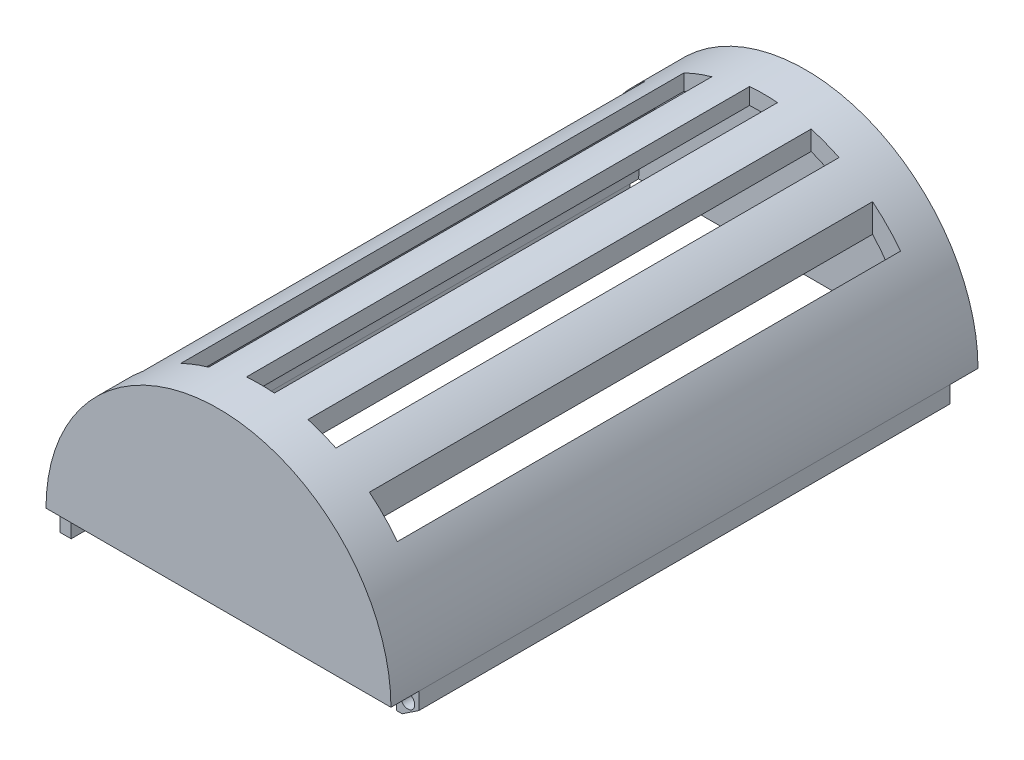
from build123d import *
from build123d.topology import SkipClean

# Parameters (mm, degrees)
EXTRUDE_1_DEPTH     = 200
SKETCH_2_W          = 10
SKETCH_2_H          = 180
CUT_EXTRUDE_1_DEPTH = 219.205820271
SKETCH_3_W          = 8
SKETCH_3_H          = 190
EXTRUDE_2_DEPTH     = 10
SKETCH_4_R          = 2.5
CUT_EXTRUDE_2_DEPTH = 214.632347738
SKETCH_5_W          = 20
SKETCH_5_H          = 3
EXTRUDE_3_DEPTH     = 10
CUT_EXTRUDE_3_DEPTH = 217.732046546
EXTRUDE_4_DEPTH     = 5
EXTRUDE_START       = 5
EXTRUDE_5_DEPTH     = 5
CUT_EXTRUDE_START   = -3
CUT_EXTRUDE_4_DEPTH = 3
CUT_EXTRUDE_5_DEPTH = 3


with BuildPart() as part:
    # 草圖1 → 填料-伸長1 (new body)
    with BuildSketch(Plane.XY):
        with BuildLine():
            Line((-61.7, 0), (-61.7, -10))
            Line((-61.7, -10), (-57.7, -10))
            Line((-57.7, -10), (-57.7, 0))
            ThreePointArc((-57.7, 0), (-2, 55.7), (53.7, 0))
            Line((53.7, 0), (61.7, 0))
            ThreePointArc((61.7, 0), (0, 61.7), (-61.7, 0))
        make_face()
    extrude(amount=EXTRUDE_1_DEPTH)

    # 草圖2 → 除料-伸長1 (cut, through all)
    with BuildSketch(Plane(origin=(0, 0, 0), x_dir=(1, 0, 0), z_dir=(0, 1, 0))):
        with Locations((0, -100)):
            Rectangle(SKETCH_2_W, SKETCH_2_H)
        with Locations((22, -100)):
            Rectangle(SKETCH_2_W, SKETCH_2_H)
        with Locations((44, -100)):
            Rectangle(SKETCH_2_W, SKETCH_2_H)
        with Locations((-21.943943619, -101.569502613)):
            Rectangle(SKETCH_2_W, SKETCH_2_H)
        with Locations((-43.887887238, -103.139005227)):
            Rectangle(SKETCH_2_W, SKETCH_2_H)
    extrude(amount=CUT_EXTRUDE_1_DEPTH, mode=Mode.SUBTRACT)

    # 草圖3 → 填料-伸長2 (add)
    with BuildSketch(Plane.XZ):
        with Locations((57.7, 100)):
            Rectangle(SKETCH_3_W, SKETCH_3_H)
    extrude(amount=EXTRUDE_2_DEPTH)

    # 草圖4 → 除料-伸長2 (cut, through all)
    with BuildSketch(Plane.XY.offset(195)):
        with Locations((57.7, -5)):
            Circle(SKETCH_4_R)
    extrude(amount=-CUT_EXTRUDE_2_DEPTH, mode=Mode.SUBTRACT)

    # 草圖5 → 填料-伸長3 (add)
    with BuildSketch(Plane.ZY.offset(61.7)):
        with Locations((100, -8.5)):
            Rectangle(SKETCH_5_W, SKETCH_5_H)
    extrude(amount=EXTRUDE_3_DEPTH)

    # 草圖6 → 除料-伸長3 (cut, through all)
    with BuildSketch(Plane.XY.offset(195)):
        Polygon((61.7, -10), (61.7, -6), (55.7, -10), align=None)
    extrude(amount=-CUT_EXTRUDE_3_DEPTH, mode=Mode.SUBTRACT)

    # 草圖7 → 填料-伸長4 (add)
    with SkipClean():  # the faces are left unmerged after this step: merging them gives an invalid solid
        with BuildSketch(Plane.XY.offset(200)):
            with BuildLine():
                Line((61.7, 0), (-61.7, 0))
                ThreePointArc((-61.7, 0), (0, 61.7), (61.7, 0))
            make_face()
        extrude(amount=EXTRUDE_4_DEPTH)

    # 草圖8 → 填料-伸長5 (add)
    with SkipClean():  # the faces are left unmerged after this step: merging them gives an invalid solid
        with BuildSketch(Plane(origin=(0, 0, 0), x_dir=(-1, 0, 0), z_dir=(0, 0, -1)).offset(EXTRUDE_START)):
            with BuildLine():
                Line((-61.7, 0), (61.7, 0))
                ThreePointArc((61.7, 0), (0, 61.7), (-61.7, 0))
            make_face()
        extrude(amount=-EXTRUDE_5_DEPTH)

    # 草圖9 → 除料-伸長4 (cut)
    with SkipClean():  # the faces are left unmerged after this step: merging them gives an invalid solid
        with BuildSketch(Plane.XY.offset(CUT_EXTRUDE_START)):
            with BuildLine():
                Line((-57.7, 0), (53.7, 0))
                ThreePointArc((53.7, 0), (-2, 55.7), (-57.7, 0))
            make_face()
        extrude(amount=CUT_EXTRUDE_4_DEPTH, mode=Mode.SUBTRACT)

    # 草圖10 → 除料-伸長5 (cut)
    with SkipClean():  # the faces are left unmerged after this step: merging them gives an invalid solid
        with BuildSketch(Plane(origin=(0, 0, 200), x_dir=(-1, 0, 0), z_dir=(0, 0, -1))):
            with BuildLine():
                Line((-53.7, 0), (57.7, 0))
                ThreePointArc((57.7, 0), (2, 55.7), (-53.7, 0))
            make_face()
        extrude(amount=-CUT_EXTRUDE_5_DEPTH, mode=Mode.SUBTRACT)


solid = part.part
